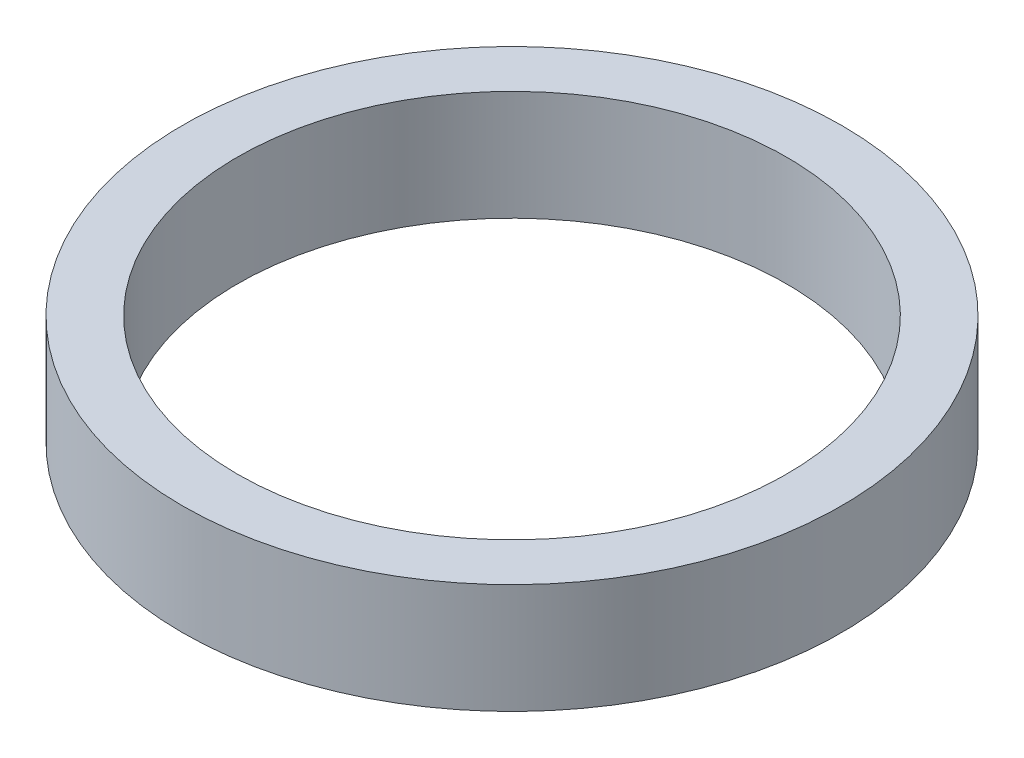
from build123d import *

# Parameters (mm, degrees)
SKETCH1_R           = 15
SKETCH1_R_2         = 12.5
BOSS_EXTRUDE1_DEPTH = 5


with BuildPart() as part:
    # Sketch1 → Boss-Extrude1 (new body)
    with BuildSketch(Plane(origin=(0, 0, 0), x_dir=(1, 0, 0), z_dir=(0, 1, 0))):
        with Locations(Location((0, 0, 0), (0, 0, 270))):
            Circle(SKETCH1_R)
        with Locations(Location((0, 0, 0), (0, 0, 270))):
            Circle(SKETCH1_R_2, mode=Mode.SUBTRACT)
    extrude(amount=BOSS_EXTRUDE1_DEPTH)


solid = part.part
